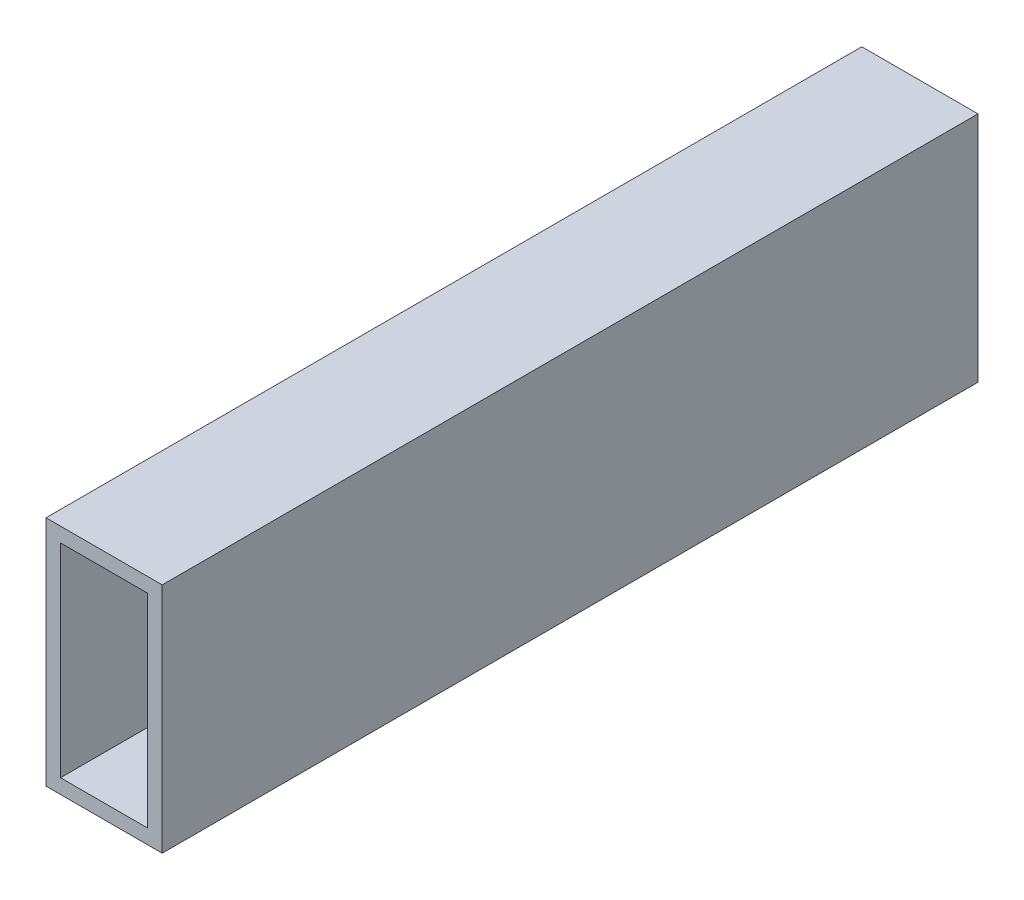
from build123d import *

# Parameters (mm, degrees)
SKETCH1_W           = 25.4
SKETCH1_H           = 50.8
SKETCH1_W_2         = 19.05
SKETCH1_H_2         = 44.45
BOSS_EXTRUDE1_DEPTH = 89.154


with BuildPart() as part:
    # Sketch1 → Boss-Extrude1 (new, symmetric)
    with BuildSketch(Plane.XY):
        Rectangle(SKETCH1_W, SKETCH1_H)
        Rectangle(SKETCH1_W_2, SKETCH1_H_2, mode=Mode.SUBTRACT)
    extrude(amount=BOSS_EXTRUDE1_DEPTH, both=True)


solid = part.part
